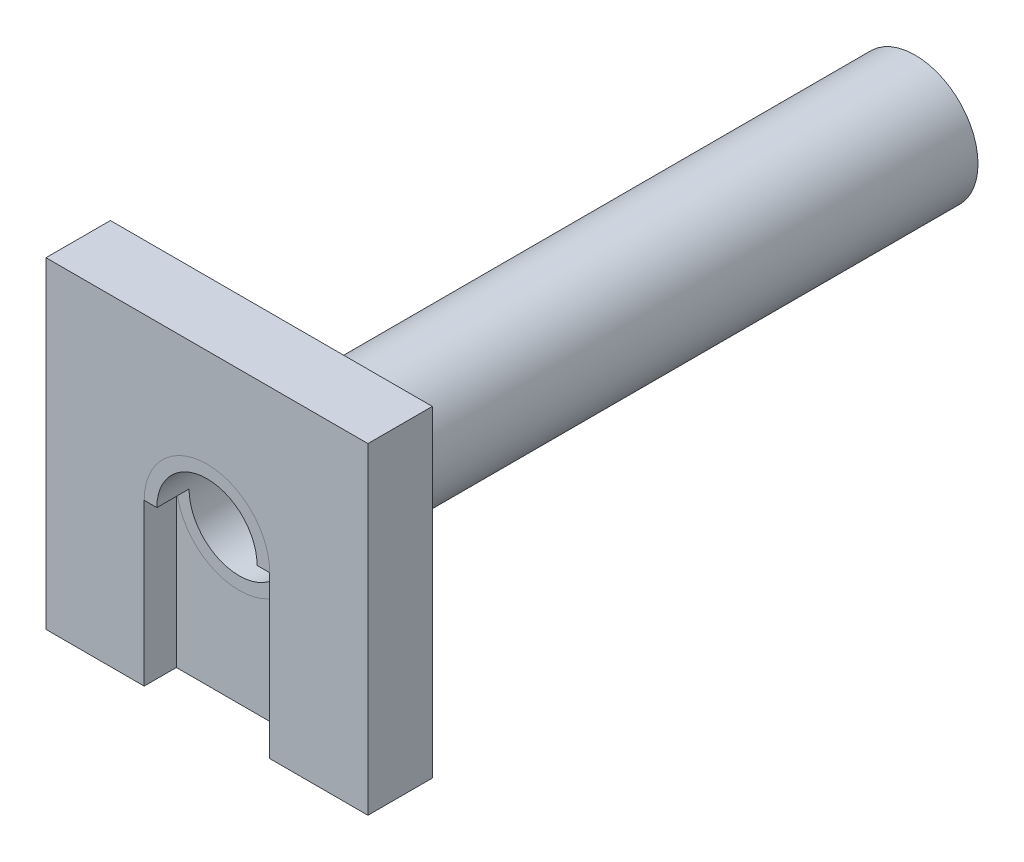
from build123d import *

# Parameters (mm, degrees)
SKETCH1_R           = 4.953
SKETCH1_R_2         = 3.953
BOSS_EXTRUDE1_DEPTH = 55.88
SKETCH2_W           = 25.4
SKETCH2_H           = 25.4
SKETCH2_R           = 4.953
BOSS_EXTRUDE2_DEPTH = 5.08
SKETCH4_W           = 9.906
SKETCH4_H           = 12.7
CUT_EXTRUDE1_DEPTH  = 2.54


with BuildPart() as part:
    # Sketch1 → Boss-Extrude1 (new body)
    with BuildSketch(Plane.XY):
        with Locations((0, 5)):
            Circle(SKETCH1_R)
        with Locations((0, 5)):
            Circle(SKETCH1_R_2, mode=Mode.SUBTRACT)
    extrude(amount=BOSS_EXTRUDE1_DEPTH)


with BuildPart() as body_2:
    # Sketch2 → Boss-Extrude2 (new body)
    with BuildSketch(Plane.XY.offset(55.88)):
        with Locations((0, 5)):
            Rectangle(SKETCH2_W, SKETCH2_H)
        with Locations((0, 5)):
            Circle(SKETCH2_R, mode=Mode.SUBTRACT)
    extrude(amount=-BOSS_EXTRUDE2_DEPTH)


with BuildPart() as cut_extrude1_tool:
    # Sketch4 → Cut-Extrude1 (new body)
    with BuildSketch(Plane(origin=(0, 0, 55.88), x_dir=(-1, 0, 0), z_dir=(0, 0, -1))):
        with Locations((0, -1.35)):
            Rectangle(SKETCH4_W, SKETCH4_H)
    extrude(amount=CUT_EXTRUDE1_DEPTH)


with BuildPart() as part_1:
    add(part.part)

    # Cut-Extrude1: cut by cut_extrude1_tool
    add(cut_extrude1_tool.part, mode=Mode.SUBTRACT)


with BuildPart() as body_2_1:
    add(body_2.part)

    # Cut-Extrude1: cut by cut_extrude1_tool
    add(cut_extrude1_tool.part, mode=Mode.SUBTRACT)


solid = Compound([part_1.part, body_2_1.part])
